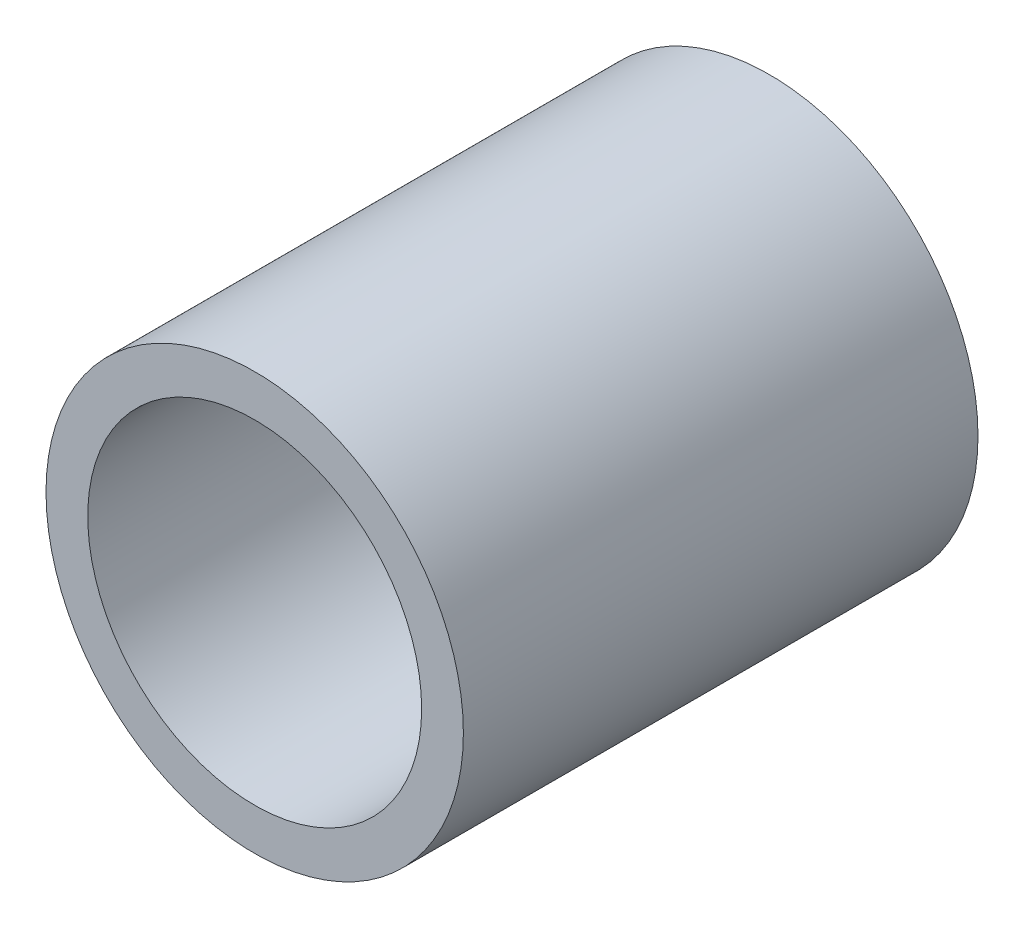
from build123d import *

# Parameters (mm, degrees)
SKETCH1_R           = 7.9375
SKETCH1_R_2         = 6.35
BOSS_EXTRUDE1_DEPTH = 9.786423658


with BuildPart() as part:
    # Sketch1 → Boss-Extrude1 (new, symmetric)
    with BuildSketch(Plane.XY):
        Circle(SKETCH1_R)
        Circle(SKETCH1_R_2, mode=Mode.SUBTRACT)
    extrude(amount=BOSS_EXTRUDE1_DEPTH, both=True)


solid = part.part
